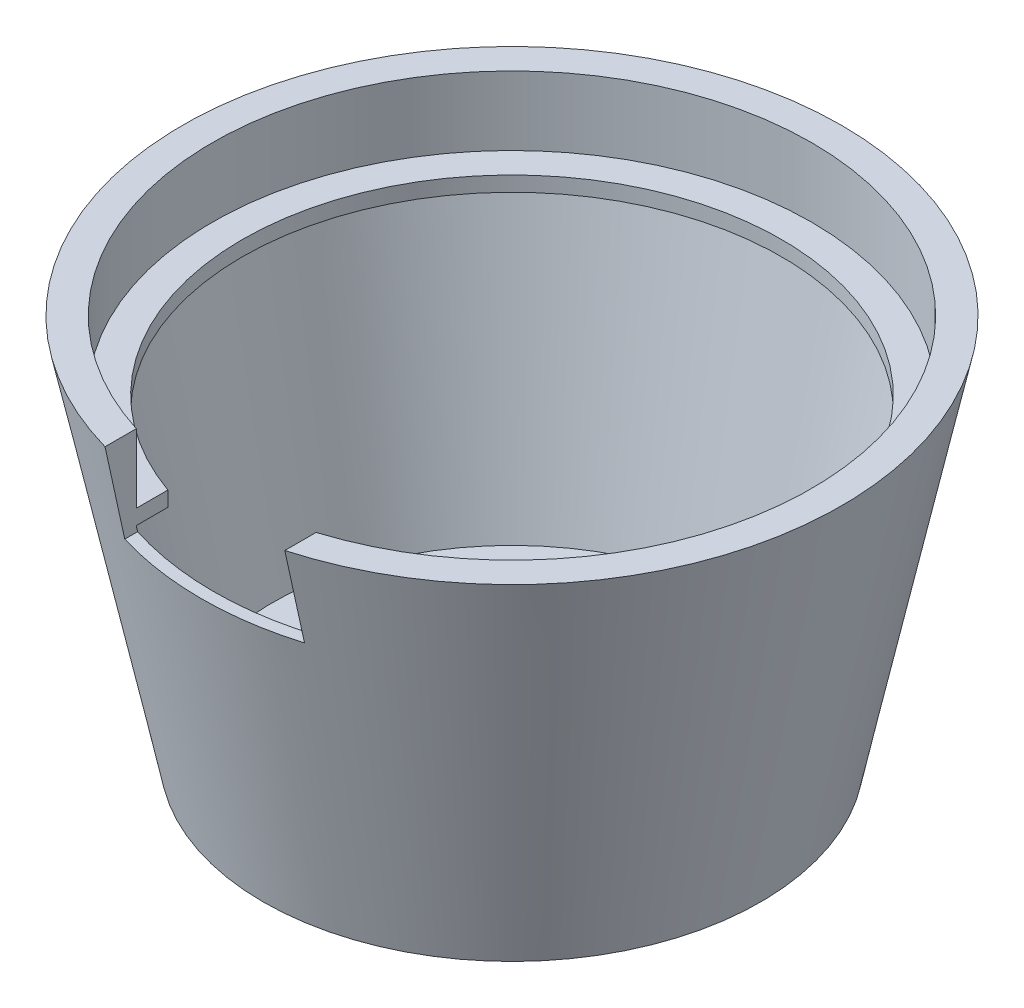
from build123d import *

# Parameters (mm, degrees)
SKETCH_2_W          = 60
SKETCH_2_H          = 57.613168724
CUT_EXTRUDE_1_DEPTH = 30


with BuildPart() as part:
    # 草圖1 → 旋轉1 (revolve)
    with BuildSketch(Plane(origin=(0, 0, 0), x_dir=(0, 0, -1), z_dir=(1, 0, 0)), mode=Mode.PRIVATE) as revolve_1_sk:
        Polygon((0, 0), (83.034457175, 0), (110, 128), (100, 128), (100, 105), (90, 105), (90, 100), (100.013488815, 100), (80, 5), (0, 5), align=None)
    revolve(revolve_1_sk.sketch.rotate(Axis((0, 5, 0), (0, -1, 0)), 180), axis=Axis((0, 5, 0), (0, -1, 0)))

    # 草圖2 → 除料-伸長1 (cut)
    with BuildSketch(Plane(origin=(0, 128, 0), x_dir=(1, 0, 0), z_dir=(0, 1, 0))):
        with Locations((0, -98.621202087)):
            Rectangle(SKETCH_2_W, SKETCH_2_H)
    extrude(amount=-CUT_EXTRUDE_1_DEPTH, mode=Mode.SUBTRACT)


solid = part.part
